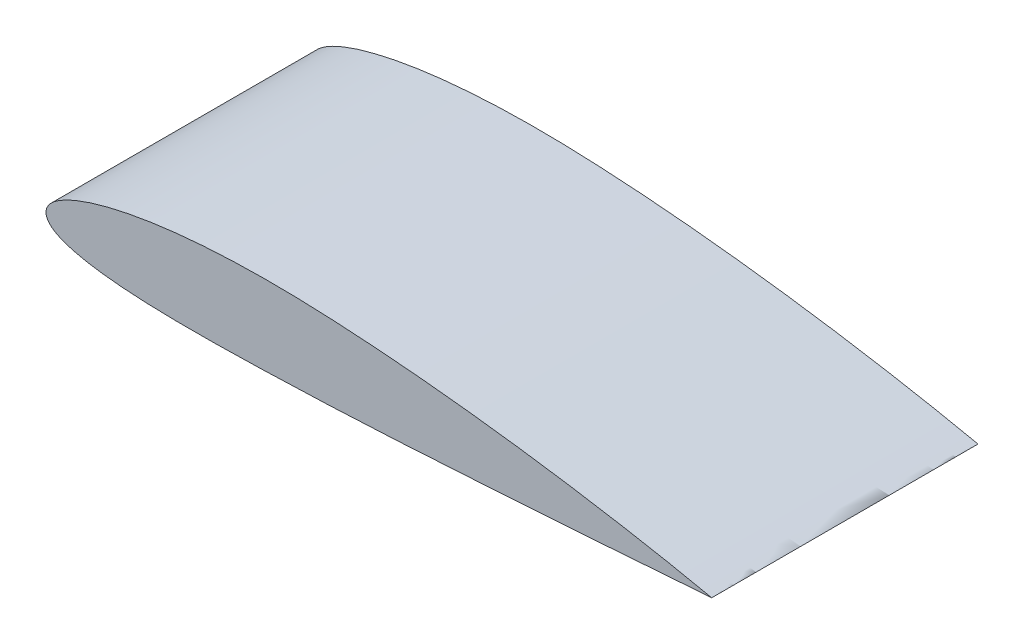
from build123d import *

# Parameters (mm, degrees)
BOSS_EXTRUDE1_DEPTH = 300


with BuildPart() as part:
    # Sketch3 → Boss-Extrude1 (new body)
    with BuildSketch(Plane.XY):
        with BuildLine():
            add(Edge.make_bspline(
                [(750, 0), (750.000596374, 0.008944343), (749.606156588, 0.071164212), (749.201769101, 0.178831621), (748.204040281, 0.379499828), (746.960563285, 0.64945627), (745.302702776, 0.999188412), (743.302006782, 1.422972164), (740.934106092, 1.92126984), (738.210413827, 2.491970567), (735.130338448, 3.133576427), (731.697748518, 3.844115034), (727.915504142, 4.621519329), (723.787220296, 5.463512142), (719.316708882, 6.367665499), (714.508147234, 7.331388516), (709.366025754, 8.351956495), (703.895159287, 9.426513234), (698.100680067, 10.552085169), (691.988036264, 11.725598042), (685.562987123, 12.94388421), (678.831600322, 14.203700088), (671.800246014, 15.50173123), (664.475593695, 16.834607159), (656.864605861, 18.198910604), (648.974533561, 19.591188061), (640.812909383, 21.007956867), (632.387542801, 22.445716187), (623.706511868, 23.900946027), (614.778158513, 25.370129876), (605.611078588, 26.849739833), (596.21411622, 28.336257769), (586.596354866, 29.826168925), (576.767109793, 31.3159701), (566.735919719, 32.802174666), (556.512536872, 34.28130837), (546.106919094, 35.749913709), (535.529221013, 37.204555405), (524.789783259, 38.641814416), (513.899123696, 40.058297245), (502.867927239, 41.450629182), (491.707036444, 42.81546227), (480.427440564, 44.149473299), (469.040265481, 45.44936805), (457.556763765, 46.711886861), (445.98830284, 47.933795364), (434.346354991, 49.111909056), (422.642486099, 50.243078472), (410.888343888, 51.324208244), (399.095648275, 52.352254791), (387.276177439, 53.324241057), (375.441758267, 54.237259082), (363.604252654, 55.088481708), (351.775547127, 55.875177885), (339.967537937, 56.594696639), (328.192124235, 57.244570473), (316.461176066, 57.822191812), (304.768306728, 58.326874321), (293.112384318, 58.75363826), (281.504387817, 59.073660222), (269.974924209, 59.290826539), (258.548725111, 59.402245831), (247.237859175, 59.407721445), (236.054271664, 59.306821025), (225.009797093, 59.099557084), (214.116133055, 58.786220325), (203.384824726, 58.367428765), (192.827247788, 57.844113841), (182.454589409, 57.21752802), (172.277833198, 56.489244162), (162.307739893, 55.661142883), (152.554832507, 54.735422588), (143.029379328, 53.714571625), (133.741378647, 52.601376165), (124.700543627, 51.398895184), (115.91628826, 50.110455645), (107.397714465, 48.739621934), (99.153598109, 47.290193079), (91.192378726, 45.766166701), (83.522147557, 44.171726614), (76.150638679, 42.511210047), (69.085218448, 40.789085372), (62.332878163, 39.009921817), (55.900225337, 37.178361887), (49.793479067, 35.299084215), (44.018459358, 33.376781627), (38.580584857, 31.416117189), (33.484863114, 29.421696959), (28.735884498, 27.39803065), (24.337810407, 25.349498923), (20.29437151, 23.280294223), (16.60884869, 21.194391856), (13.284070931, 19.095472113), (10.322413334, 16.98684329), (7.725815985, 14.871336886), (5.495866613, 12.751159477), (3.633990776, 10.627742226), (2.141850898, 8.501660718), (1.021963587, 6.372874285), (0.278257301, 4.241692942), (-0.084282047, 2.110324605), (-0.062187925, -0.006223222), (0.335244441, -2.085088265), (1.110923569, -4.102406055), (2.257001313, -6.044895367), (3.766897922, -7.912321423), (5.635538408, -9.706267437), (7.859354737, -11.428580296), (10.43555234, -13.080561608), (13.36146593, -14.662884176), (16.634217933, -16.175722799), (20.250562423, -17.618947053), (24.206851839, -18.992249961), (28.49903882, -20.295257982), (33.122704468, -21.527574005), (38.073076319, -22.68885108), (43.345058825, -23.77879257), (48.933250197, -24.797204518), (54.83196383, -25.743990868), (61.035243207, -26.619184363), (67.536873968, -27.422959533), (74.330400725, -28.155633119), (81.409134632, -28.817691096), (88.766165503, -29.409789074), (96.394370271, -29.932757085), (104.286420803, -30.387615204), (112.43479353, -30.775568897), (120.831774299, -31.098018495), (129.469465919, -31.356553231), (138.339791885, -31.552959886), (147.434503478, -31.689203615), (156.745182873, -31.767442162), (166.263248374, -31.790004762), (175.979958031, -31.759383386), (185.886412182, -31.678234958), (195.973558136, -31.549350275), (206.232191309, -31.375655488), (216.652961287, -31.160189736), (227.22637168, -30.906083681), (237.942786845, -30.616554941), (248.792431229, -30.294868042), (259.765398208, -29.944363415), (270.851644578, -29.568262881), (282.041023411, -29.170328066), (293.335847272, -28.75178037), (304.744079475, -28.321287154), (316.253882214, -27.855314511), (327.84133776, -27.35400989), (339.477036029, -26.821619365), (351.149748845, -26.260639443), (362.84820481, -25.673792303), (374.5610846, -25.063686471), (386.277034661, -24.432883078), (397.984677964, -23.783869521), (409.6726246, -23.119050855), (421.329482674, -22.440745118), (432.943869076, -21.751173396), (444.504420609, -21.052456949), (455.99980645, -20.346615235), (467.418738031, -19.635557024), (478.749982711, -18.921089997), (489.98237258, -18.20491329), (501.104817597, -17.488621503), (512.106315816, -16.773711653), (522.975966514, -16.06158392), (533.702979952, -15.353547342), (544.276689409, -14.650822276), (554.686561699, -13.954558782), (564.92220812, -13.265828027), (574.973395277, -12.585637148), (584.830057349, -11.914944848), (594.482304398, -11.254649792), (603.92043436, -10.605616036), (613.134942693, -9.968671278), (622.116532429, -9.344613661), (630.856124841, -8.734222177), (639.344868529, -8.138255064), (647.574150201, -7.557464882), (655.535603008, -6.992593405), (663.221116035, -6.4443769), (670.622845006, -5.913553606), (677.733219492, -5.400858961), (684.544953263, -4.907026641), (691.051051658, -4.432797083), (697.244821279, -3.978899728), (703.119877078, -3.546069001), (708.670151763, -3.135030909), (713.889901712, -2.74649743), (718.773715721, -2.381173746), (723.316525, -2.039744234), (727.513594945, -1.722870956), (731.360583882, -1.431187707), (734.853376596, -1.165295103), (737.988646567, -0.925772917), (740.762098965, -0.713079116), (743.173936022, -0.52788779), (745.212408393, -0.37001154), (746.901581635, -0.241554591), (748.16967874, -0.138157223), (749.185121579, -0.071371135), (749.600202193, -0.01826099), (749.999403628, -0.008944305), (750, 0)],
                knots=[0, 0, 0, 0, 0.00012238, 0.000489394, 0.001100671, 0.001955591, 0.003053288, 0.004392651, 0.005972323, 0.007790709, 0.009845969, 0.012136029, 0.014658579, 0.017411077, 0.020390754, 0.023594612, 0.027019434, 0.030661785, 0.034518016, 0.038584266, 0.042856471, 0.047330365, 0.052001484, 0.056865175, 0.061916594, 0.067150718, 0.072562344, 0.078146096, 0.083896435, 0.089807655, 0.095873895, 0.102089145, 0.108447246, 0.114941901, 0.121566677, 0.128315017, 0.135180238, 0.142155541, 0.14923402, 0.156408667, 0.163672374, 0.171017946, 0.178438106, 0.185925504, 0.193472719, 0.201072274, 0.208716637, 0.216398235, 0.224109459, 0.231842672, 0.23959022, 0.247344439, 0.255097663, 0.262842236, 0.270570519, 0.2782749, 0.285947802, 0.293581693, 0.301204963, 0.308799342, 0.316332599, 0.323797398, 0.33118649, 0.338492716, 0.345709024, 0.352828469, 0.359844228, 0.366749609, 0.373538053, 0.380203152, 0.386738649, 0.393138451, 0.399396638, 0.40550747, 0.411465396, 0.417265066, 0.422901335, 0.428369281, 0.433664213, 0.438781684, 0.443717506, 0.448467769, 0.453028862, 0.457397495, 0.461570729, 0.465546018, 0.469321251, 0.472894812, 0.476265657, 0.479433416, 0.482398522, 0.485162391, 0.487727657, 0.490098505, 0.49228111, 0.494284244, 0.496120073, 0.497805161, 0.499361588, 0.50081788, 0.502209191, 0.50357598, 0.504942763, 0.506333878, 0.507789315, 0.509343563, 0.511024415, 0.512853216, 0.514845834, 0.517013792, 0.519365264, 0.521905878, 0.524639317, 0.527567756, 0.530692199, 0.534012706, 0.537528579, 0.541238492, 0.545140593, 0.549232579, 0.55351176, 0.5579751, 0.562619263, 0.567440635, 0.572435355, 0.577599329, 0.582928253, 0.588417623, 0.594062747, 0.599858757, 0.605800613, 0.611883118, 0.61810092, 0.624448516, 0.630920265, 0.637510387, 0.644212972, 0.65102198, 0.657931256, 0.664934522, 0.672025395, 0.679197381, 0.686443892, 0.693758239, 0.701133649, 0.708588087, 0.716125336, 0.723702287, 0.731311634, 0.738946019, 0.746598038, 0.754260251, 0.761925188, 0.769585361, 0.777233271, 0.784861416, 0.792462299, 0.800028438, 0.80755237, 0.815026666, 0.822443931, 0.82979682, 0.837078038, 0.844280353, 0.851396601, 0.858419694, 0.865342628, 0.872158489, 0.878860459, 0.885441825, 0.891895984, 0.898216451, 0.904396866, 0.910430996, 0.916312749, 0.922036172, 0.927595463, 0.932984975, 0.938199223, 0.943232886, 0.94808082, 0.952738059, 0.957199818, 0.961461508, 0.965518732, 0.969367296, 0.973003211, 0.976422702, 0.979622209, 0.982598395, 0.98534815, 0.987868592, 0.990157079, 0.992211202, 0.994028801, 0.995607959, 0.996947006, 0.99804453, 0.998899368, 0.999510614, 0.999877621, 1, 1, 1, 1], degree=3))
        make_face()
    extrude(amount=BOSS_EXTRUDE1_DEPTH)


solid = part.part
